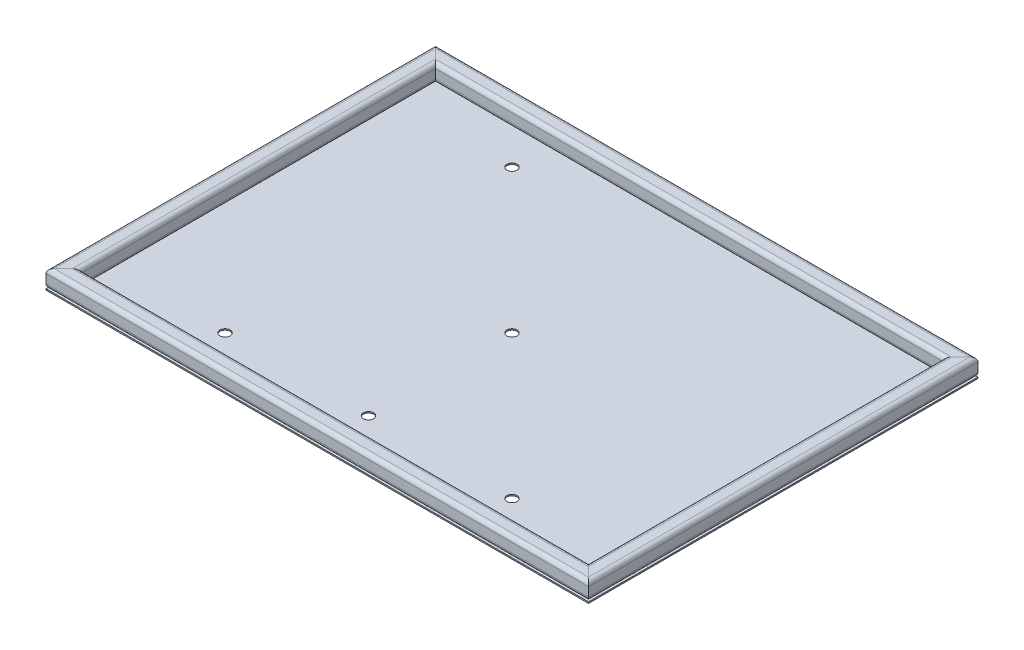
from build123d import *

# Parameters (mm, degrees)
TUBO_CUADRADO_2_X_2_X_0_25_1_DEPTH      = 606.921024484
TUBO_CUADRADO_2_X_2_X_0_25_1_DEPTH_BACK = 36.921024484
TUBO_CUADRADO_2_X_2_X_0_25_1_2_DEPTH    = 867.842048969
TUBO_CUADRADO_2_X_2_X_0_25_1_3_DEPTH    = 643.842048969
TUBO_CUADRADO_2_X_2_X_0_25_1_4_DEPTH    = 867.842048969
CROQUIS3_W                              = 794
CROQUIS3_H                              = 570
SALIENTE_EXTRUIR1_DEPTH                 = 1.9
CROQUIS6_R                              = 7.5
CORTAR_EXTRUIR2_DEPTH                   = 10


with BuildPart() as part:
    # Sketch1 → Tubo cuadrado 2 X 2 X 0.25(1) (new, two sides: drawn at the far end of the back side and taken through both)
    with BuildSketch(Plane(origin=(-384.3, 12.7, -285), x_dir=(1, 0, 0), z_dir=(0, 0, 1)).offset(-TUBO_CUADRADO_2_X_2_X_0_25_1_DEPTH_BACK)):
        with BuildLine():
            Line((-6.7, -12.7), (6.7, -12.7))
            ThreePointArc((6.7, -12.7), (10.942640687, -10.942640687), (12.7, -6.7))
            Line((12.7, -6.7), (12.7, 6.7))
            ThreePointArc((12.7, 6.7), (10.942640687, 10.942640687), (6.7, 12.7))
            Line((6.7, 12.7), (-6.7, 12.7))
            ThreePointArc((-6.7, 12.7), (-10.942640687, 10.942640687), (-12.7, 6.7))
            Line((-12.7, 6.7), (-12.7, -6.7))
            ThreePointArc((-12.7, -6.7), (-10.942640687, -10.942640687), (-6.7, -12.7))
        make_face()
        with BuildLine():
            Line((-6.7, -9.7), (6.7, -9.7))
            ThreePointArc((6.7, -9.7), (8.821320344, -8.821320344), (9.7, -6.7))
            Line((9.7, -6.7), (9.7, 6.7))
            ThreePointArc((9.7, 6.7), (8.821320344, 8.821320344), (6.7, 9.7))
            Line((6.7, 9.7), (-6.7, 9.7))
            ThreePointArc((-6.7, 9.7), (-8.821320344, 8.821320344), (-9.7, 6.7))
            Line((-9.7, 6.7), (-9.7, -6.7))
            ThreePointArc((-9.7, -6.7), (-8.821320344, -8.821320344), (-6.7, -9.7))
        make_face(mode=Mode.SUBTRACT)
    extrude(amount=TUBO_CUADRADO_2_X_2_X_0_25_1_DEPTH + TUBO_CUADRADO_2_X_2_X_0_25_1_DEPTH_BACK)

    # Tubo cuadrado 2 X 2 X 0.25(1) mitre 1
    split(bisect_by=Plane(origin=(-397, 0, -285), x_dir=(0, -1, 0), z_dir=(-0.707106781, 0, 0.707106781)), keep=Keep.TOP)

    # Tubo cuadrado 2 X 2 X 0.25(1) mitre 2
    split(bisect_by=Plane(origin=(-397, 0, 285), x_dir=(0, -1, 0), z_dir=(-0.707106781, 0, -0.707106781)), keep=Keep.TOP)


with BuildPart() as body_2:
    # Sketch1 on segment 2 (carried to segment 2) → Tubo cuadrado 2 X 2 X 0.25_1 2 (new body)
    with BuildSketch(Plane(origin=(-433.921024484, 12.7, 272.3), x_dir=(0, 0, -1), z_dir=(1, 0, 0))):
        with BuildLine():
            Line((-6.7, -12.7), (6.7, -12.7))
            ThreePointArc((6.7, -12.7), (10.942640687, -10.942640687), (12.7, -6.7))
            Line((12.7, -6.7), (12.7, 6.7))
            ThreePointArc((12.7, 6.7), (10.942640687, 10.942640687), (6.7, 12.7))
            Line((6.7, 12.7), (-6.7, 12.7))
            ThreePointArc((-6.7, 12.7), (-10.942640687, 10.942640687), (-12.7, 6.7))
            Line((-12.7, 6.7), (-12.7, -6.7))
            ThreePointArc((-12.7, -6.7), (-10.942640687, -10.942640687), (-6.7, -12.7))
        make_face()
        with BuildLine():
            Line((-6.7, -9.7), (6.7, -9.7))
            ThreePointArc((6.7, -9.7), (8.821320344, -8.821320344), (9.7, -6.7))
            Line((9.7, -6.7), (9.7, 6.7))
            ThreePointArc((9.7, 6.7), (8.821320344, 8.821320344), (6.7, 9.7))
            Line((6.7, 9.7), (-6.7, 9.7))
            ThreePointArc((-6.7, 9.7), (-8.821320344, 8.821320344), (-9.7, 6.7))
            Line((-9.7, 6.7), (-9.7, -6.7))
            ThreePointArc((-9.7, -6.7), (-8.821320344, -8.821320344), (-6.7, -9.7))
        make_face(mode=Mode.SUBTRACT)
    extrude(amount=TUBO_CUADRADO_2_X_2_X_0_25_1_2_DEPTH)

    # Tubo cuadrado 2 X 2 X 0.25_1 2 mitre 1
    split(bisect_by=Plane(origin=(-397, 0, 285), x_dir=(0, 1, 0), z_dir=(0.707106781, 0, 0.707106781)), keep=Keep.TOP)

    # Tubo cuadrado 2 X 2 X 0.25_1 2 mitre 2
    split(bisect_by=Plane(origin=(397, 0, 285), x_dir=(0, -1, 0), z_dir=(-0.707106781, 0, 0.707106781)), keep=Keep.TOP)


with BuildPart() as body_3:
    # Sketch1 on segment 3 (carried to segment 3) → Tubo cuadrado 2 X 2 X 0.25_1 3 (new body)
    with BuildSketch(Plane(origin=(384.3, 12.7, 321.921024484), x_dir=(-1, 0, 0), z_dir=(0, 0, -1))):
        with BuildLine():
            Line((-6.7, -12.7), (6.7, -12.7))
            ThreePointArc((6.7, -12.7), (10.942640687, -10.942640687), (12.7, -6.7))
            Line((12.7, -6.7), (12.7, 6.7))
            ThreePointArc((12.7, 6.7), (10.942640687, 10.942640687), (6.7, 12.7))
            Line((6.7, 12.7), (-6.7, 12.7))
            ThreePointArc((-6.7, 12.7), (-10.942640687, 10.942640687), (-12.7, 6.7))
            Line((-12.7, 6.7), (-12.7, -6.7))
            ThreePointArc((-12.7, -6.7), (-10.942640687, -10.942640687), (-6.7, -12.7))
        make_face()
        with BuildLine():
            Line((-6.7, -9.7), (6.7, -9.7))
            ThreePointArc((6.7, -9.7), (8.821320344, -8.821320344), (9.7, -6.7))
            Line((9.7, -6.7), (9.7, 6.7))
            ThreePointArc((9.7, 6.7), (8.821320344, 8.821320344), (6.7, 9.7))
            Line((6.7, 9.7), (-6.7, 9.7))
            ThreePointArc((-6.7, 9.7), (-8.821320344, 8.821320344), (-9.7, 6.7))
            Line((-9.7, 6.7), (-9.7, -6.7))
            ThreePointArc((-9.7, -6.7), (-8.821320344, -8.821320344), (-6.7, -9.7))
        make_face(mode=Mode.SUBTRACT)
    extrude(amount=TUBO_CUADRADO_2_X_2_X_0_25_1_3_DEPTH)

    # Tubo cuadrado 2 X 2 X 0.25_1 3 mitre 1
    split(bisect_by=Plane(origin=(397, 0, -285), x_dir=(0, 1, 0), z_dir=(0.707106781, 0, 0.707106781)), keep=Keep.TOP)

    # Tubo cuadrado 2 X 2 X 0.25_1 3 mitre 2
    split(bisect_by=Plane(origin=(397, 0, 285), x_dir=(0, 1, 0), z_dir=(0.707106781, 0, -0.707106781)), keep=Keep.TOP)


with BuildPart() as body_4:
    # Sketch1 on segment 4 (carried to segment 4) → Tubo cuadrado 2 X 2 X 0.25_1 4 (new body)
    with BuildSketch(Plane(origin=(433.921024484, 12.7, -272.3), x_dir=(0, 0, 1), z_dir=(-1, 0, 0))):
        with BuildLine():
            Line((-6.7, -12.7), (6.7, -12.7))
            ThreePointArc((6.7, -12.7), (10.942640687, -10.942640687), (12.7, -6.7))
            Line((12.7, -6.7), (12.7, 6.7))
            ThreePointArc((12.7, 6.7), (10.942640687, 10.942640687), (6.7, 12.7))
            Line((6.7, 12.7), (-6.7, 12.7))
            ThreePointArc((-6.7, 12.7), (-10.942640687, 10.942640687), (-12.7, 6.7))
            Line((-12.7, 6.7), (-12.7, -6.7))
            ThreePointArc((-12.7, -6.7), (-10.942640687, -10.942640687), (-6.7, -12.7))
        make_face()
        with BuildLine():
            Line((-6.7, -9.7), (6.7, -9.7))
            ThreePointArc((6.7, -9.7), (8.821320344, -8.821320344), (9.7, -6.7))
            Line((9.7, -6.7), (9.7, 6.7))
            ThreePointArc((9.7, 6.7), (8.821320344, 8.821320344), (6.7, 9.7))
            Line((6.7, 9.7), (-6.7, 9.7))
            ThreePointArc((-6.7, 9.7), (-8.821320344, 8.821320344), (-9.7, 6.7))
            Line((-9.7, 6.7), (-9.7, -6.7))
            ThreePointArc((-9.7, -6.7), (-8.821320344, -8.821320344), (-6.7, -9.7))
        make_face(mode=Mode.SUBTRACT)
    extrude(amount=TUBO_CUADRADO_2_X_2_X_0_25_1_4_DEPTH)

    # Tubo cuadrado 2 X 2 X 0.25_1 4 mitre 1
    split(bisect_by=Plane(origin=(-397, 0, -285), x_dir=(0, 1, 0), z_dir=(0.707106781, 0, -0.707106781)), keep=Keep.TOP)

    # Tubo cuadrado 2 X 2 X 0.25_1 4 mitre 2
    split(bisect_by=Plane(origin=(397, 0, -285), x_dir=(0, -1, 0), z_dir=(-0.707106781, 0, -0.707106781)), keep=Keep.TOP)


with BuildPart() as body_5:
    # Croquis3 → Saliente-Extruir1 (new body)
    with BuildSketch(Plane.XZ):
        Rectangle(CROQUIS3_W, CROQUIS3_H)
    extrude(amount=SALIENTE_EXTRUIR1_DEPTH)

    # Croquis6 → Cortar-Extruir2 (cut)
    with BuildSketch(Plane.XZ.offset(1.9)):
        Circle(CROQUIS6_R)
        with Locations((210, 210)):
            Circle(CROQUIS6_R)
        with Locations((-210, 210)):
            Circle(CROQUIS6_R)
        with Locations((-210, -210)):
            Circle(CROQUIS6_R)
        with Locations((0, 210)):
            Circle(CROQUIS6_R)
    extrude(amount=-CORTAR_EXTRUIR2_DEPTH, mode=Mode.SUBTRACT)


solid = Compound([part.part, body_2.part, body_3.part, body_4.part, body_5.part])
